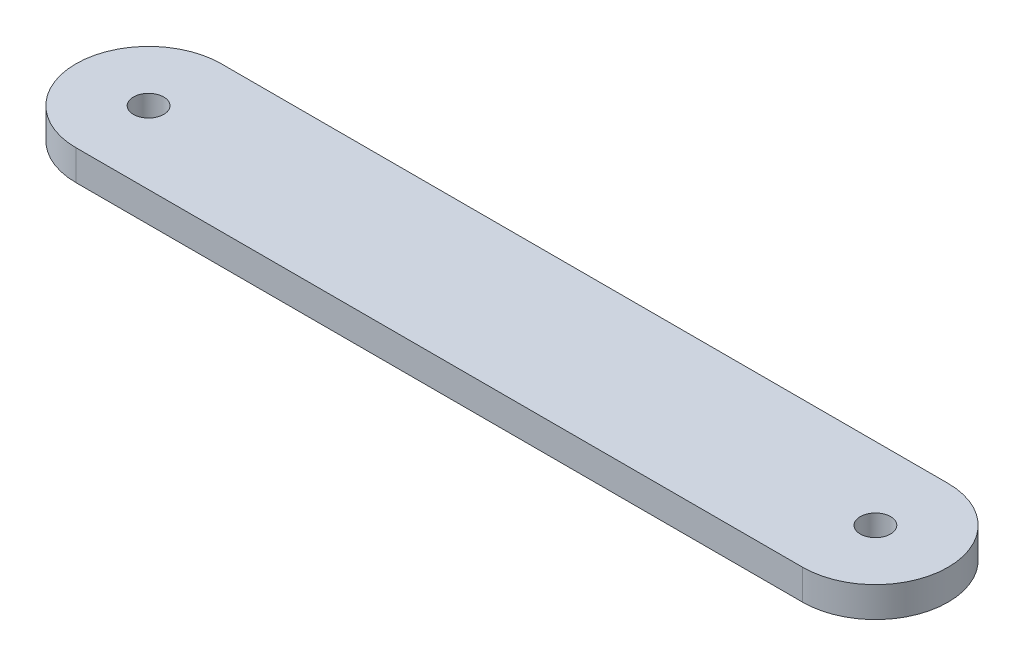
from build123d import *

# Parameters (mm, degrees)
SKETCH_1_R      = 2.5
EXTRUDE_1_DEPTH = 5


with BuildPart() as part:
    # Эскиз1 → Вытянуть1 (new body)
    with BuildSketch(Plane(origin=(0, 0, 0), x_dir=(1, 0, 0), z_dir=(0, 1, 0))):
        with BuildLine():
            Line((0, 10.177767955), (120, 10.177767955))
            ThreePointArc((120, 10.177767955), (132, -1.822232045), (120, -13.822232045))
            Line((120, -13.822232045), (0, -13.822232045))
            ThreePointArc((0, -13.822232045), (-12, -1.822232045), (0, 10.177767955))
        make_face()
        with Locations(Location((0, -1.822232045, 0), (0, 0, 270))):
            Circle(SKETCH_1_R, mode=Mode.SUBTRACT)
        with Locations(Location((120, -1.822232045, 0), (0, 0, 270))):
            Circle(SKETCH_1_R, mode=Mode.SUBTRACT)
    extrude(amount=EXTRUDE_1_DEPTH)


solid = part.part
